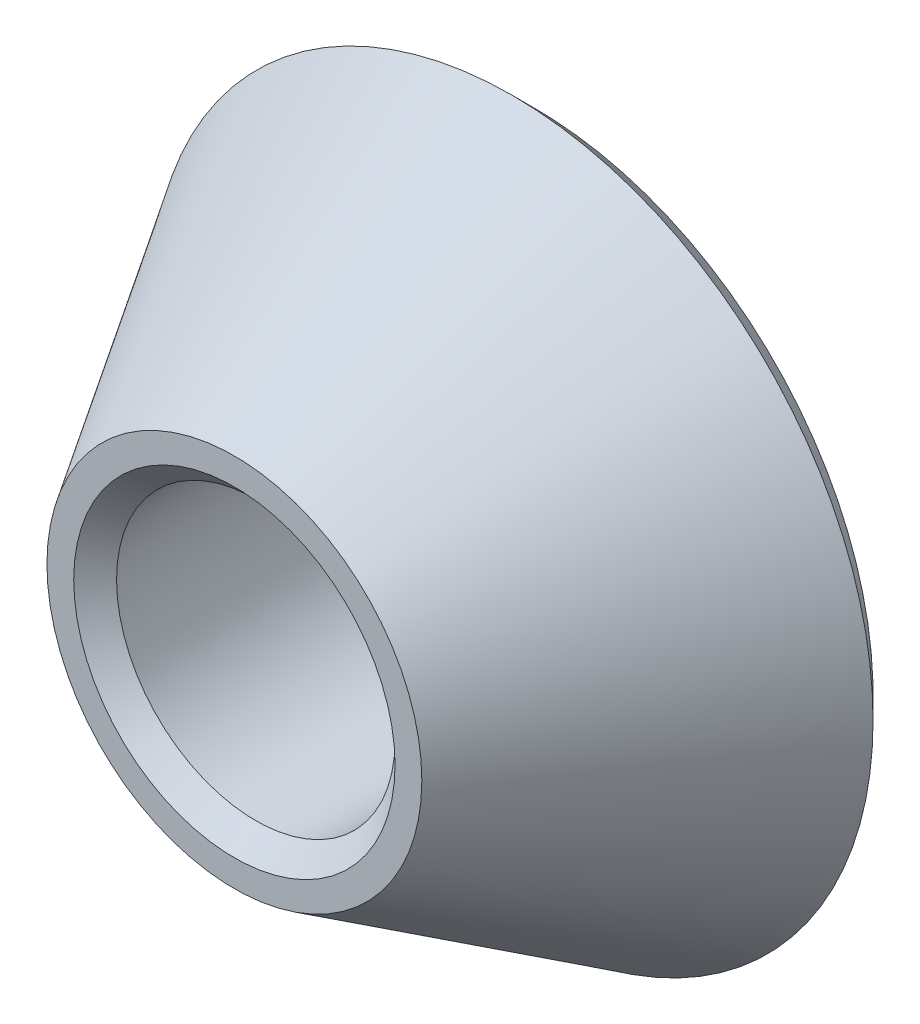
from build123d import *

# Parameters (mm, degrees)
FASE1_SIZE = 0.4


with BuildPart() as part:
    # Skizze5 → Rotation1 (revolve)
    with BuildSketch(Plane(origin=(0, 0, 0), x_dir=(0, 0, -1), z_dir=(1, 0, 0)), mode=Mode.PRIVATE) as rotation1_sk:
        Polygon((0, 2.6), (-5.6, 2.6), (-5.6, 3.5), (-0.415050889, 6.740593194), (0, 6.325542305), align=None)
    revolve(rotation1_sk.sketch.rotate(Axis((0, 0, 0), (0, 0, 1)), 90), axis=Axis((0, 0, 0), (0, 0, 1)))

    # Fase1
    fase1_edges = [part.edges().sort_by_distance(p)[0] for p in [
        (2.6, 0, 5.6),
        (2.6, 0, 0),
    ]]
    chamfer(fase1_edges, length=FASE1_SIZE)


solid = part.part
